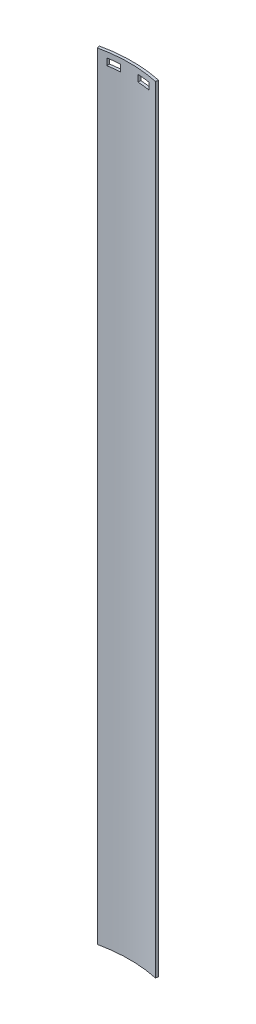
from build123d import *

# Parameters (mm, degrees)
BOSS_EXTRUDE1_DEPTH     = 720
CUT_EXTRUDE6_DEPTH      = 723.121476834
CUT_EXTRUDE6_DEPTH_BACK = 723.121476834
SKETCH8_W               = 22.5
SKETCH8_H               = 12.5


with BuildPart() as part:
    # Sketch3 → Boss-Extrude1 (new, symmetric)
    with BuildSketch(Plane(origin=(0, 0, 0), x_dir=(1, 0, 0), z_dir=(0, 1, 0))):
        with BuildLine():
            Line((-55, -0.016406212), (-53.942307692, -4.903254581))
            ThreePointArc((-53.942307692, -4.903254581), (0, 0.867478597), (53.942307692, -4.903254581))
            Line((53.942307692, -4.903254581), (55, -0.016406212))
            ThreePointArc((55, -0.016406212), (0, 5.867478597), (-55, -0.016406212))
        make_face()
    extrude(amount=BOSS_EXTRUDE1_DEPTH, both=True)

    # Sketch8 → Cut-Extrude6 (cut, two sides: drawn at the far end of the back side and taken through both)
    with BuildSketch(Plane.XY.offset(-CUT_EXTRUDE6_DEPTH_BACK)):
        with Locations((-27.692307692, 703.75)):
            Rectangle(SKETCH8_W, SKETCH8_H)
        with Locations((27.692307692, 703.75)):
            Rectangle(SKETCH8_W, SKETCH8_H)
    extrude(amount=CUT_EXTRUDE6_DEPTH + CUT_EXTRUDE6_DEPTH_BACK, mode=Mode.SUBTRACT)


solid = part.part
